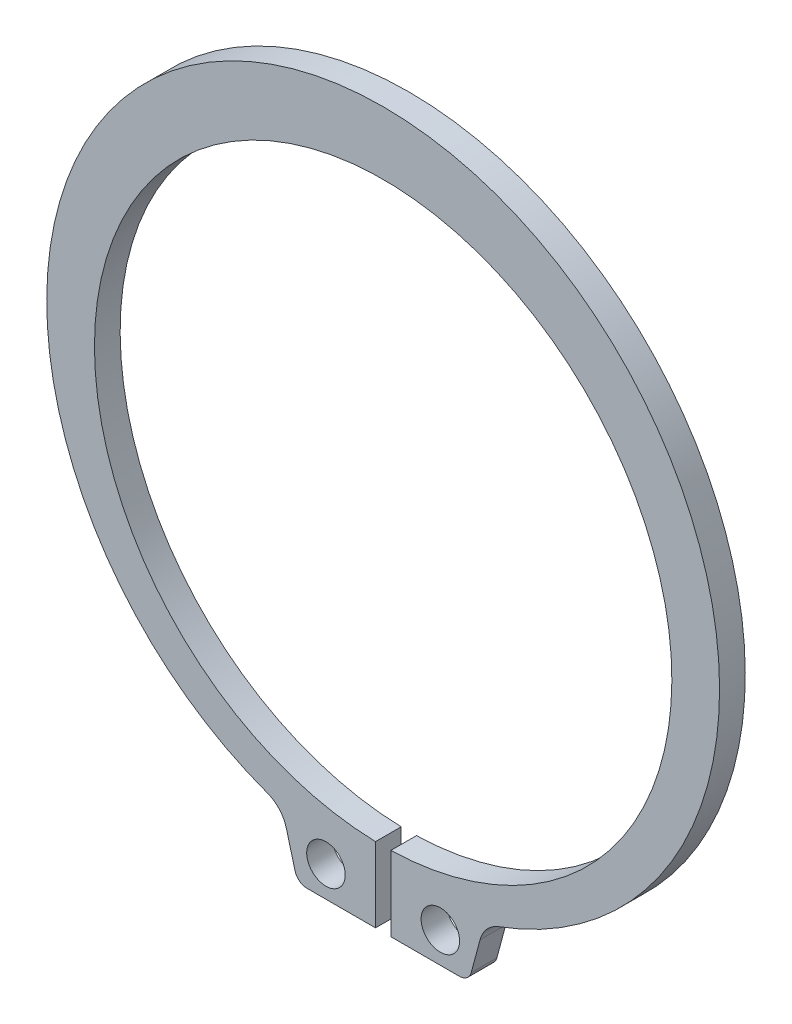
from build123d import *

# Parameters (mm, degrees)
BASE_SKETCH_R    = 11.9888
BASE_SKETCH_R_2  = 0.8001
BASE_DEPTH       = 1.0668
CUT_SKETCH_W     = 0.635
CUT_SKETCH_H     = 7.458306792
BOTTOM_CUT_DEPTH = 22.059418629


with BuildPart() as part:
    # Base Sketch → Base (new body)
    with BuildSketch(Plane.XY):
        with BuildLine():
            Line((-3.16619789, -15.7226), (3.16619789, -15.7226))
            ThreePointArc((3.16619789, -15.7226), (3.475448696, -15.617623497), (3.65688821, -15.346080075))
            Line((3.65688821, -15.346080075), (4.023345402, -13.978443217))
            ThreePointArc((4.023345402, -13.978443217), (4.312600377, -13.450377126), (4.812565268, -13.114881454))
            ThreePointArc((4.812565268, -13.114881454), (0, 13.97), (-4.812565268, -13.114881454))
            ThreePointArc((-4.812565268, -13.114881454), (-4.312600377, -13.450377126), (-4.023345402, -13.978443217))
            Line((-4.023345402, -13.978443217), (-3.65688821, -15.346080075))
            ThreePointArc((-3.65688821, -15.346080075), (-3.475448696, -15.617623497), (-3.16619789, -15.7226))
        make_face()
        with Locations((0, -0.635)):
            Circle(BASE_SKETCH_R, mode=Mode.SUBTRACT)
        with Locations((2.3749, -14.4526)):
            Circle(BASE_SKETCH_R_2, mode=Mode.SUBTRACT)
        with Locations((-2.3749, -14.4526)):
            Circle(BASE_SKETCH_R_2, mode=Mode.SUBTRACT)
    extrude(amount=BASE_DEPTH)

    # Cut Sketch → Bottom Cut (cut, through all)
    with BuildSketch(Plane.XY.offset(1.0668)):
        with Locations((0, -12.6238)):
            Rectangle(CUT_SKETCH_W, CUT_SKETCH_H)
    extrude(amount=-BOTTOM_CUT_DEPTH, mode=Mode.SUBTRACT)


solid = part.part
